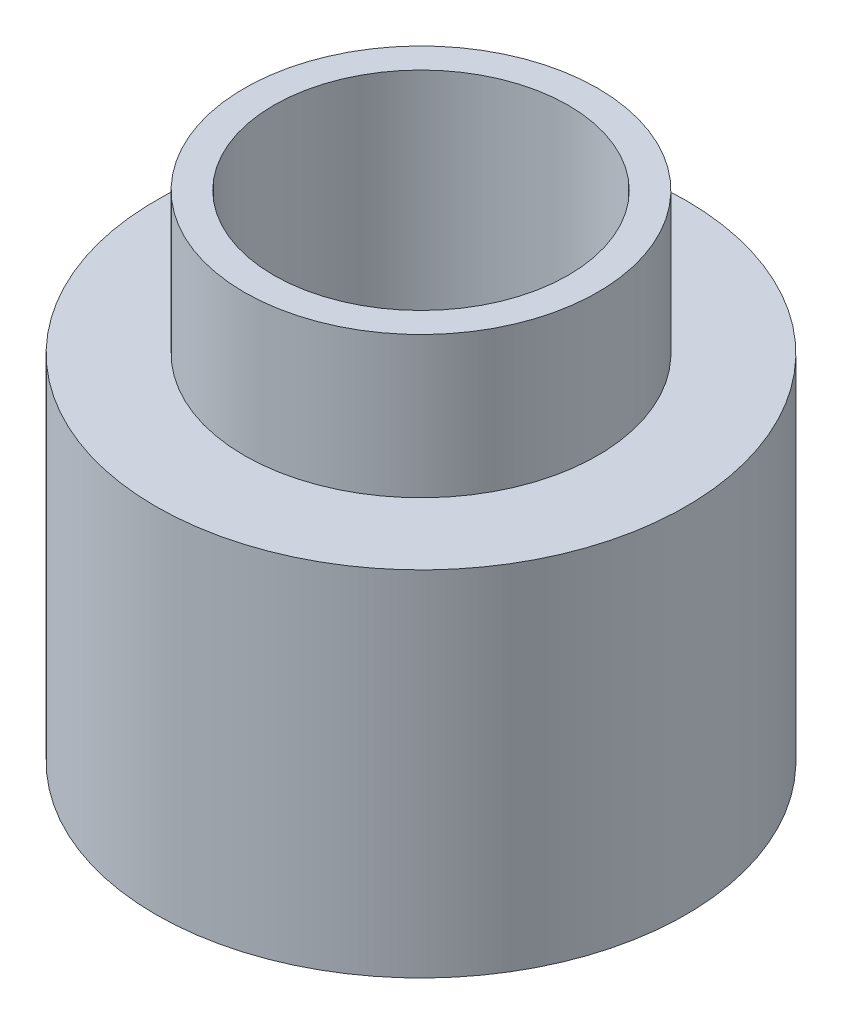
from build123d import *

# Parameters (mm, degrees)
SKETCH_1_R      = 2.25
SKETCH_1_R_2    = 1.25
EXTRUDE_1_DEPTH = 3
SKETCH_2_R      = 1.5
SKETCH_2_R_2    = 1.25
EXTRUDE_2_DEPTH = 1.2


with BuildPart() as part:
    # 草图1 → 凸台-拉伸1 (new body)
    with BuildSketch(Plane(origin=(0, 0, 0), x_dir=(1, 0, 0), z_dir=(0, 1, 0))):
        with Locations(Location((0, 0, 0), (0, 0, 270))):
            Circle(SKETCH_1_R)
        with Locations(Location((0, 0, 0), (0, 0, 270))):
            Circle(SKETCH_1_R_2, mode=Mode.SUBTRACT)
    extrude(amount=EXTRUDE_1_DEPTH)

    # 草图2 → 凸台-拉伸2 (add)
    with BuildSketch(Plane(origin=(0, 3, 0), x_dir=(1, 0, 0), z_dir=(0, 1, 0))):
        with Locations(Location((0, 0, 0), (0, 0, 270))):
            Circle(SKETCH_2_R)
        with Locations(Location((0, 0, 0), (0, 0, 270))):
            Circle(SKETCH_2_R_2, mode=Mode.SUBTRACT)
    extrude(amount=EXTRUDE_2_DEPTH)


solid = part.part
